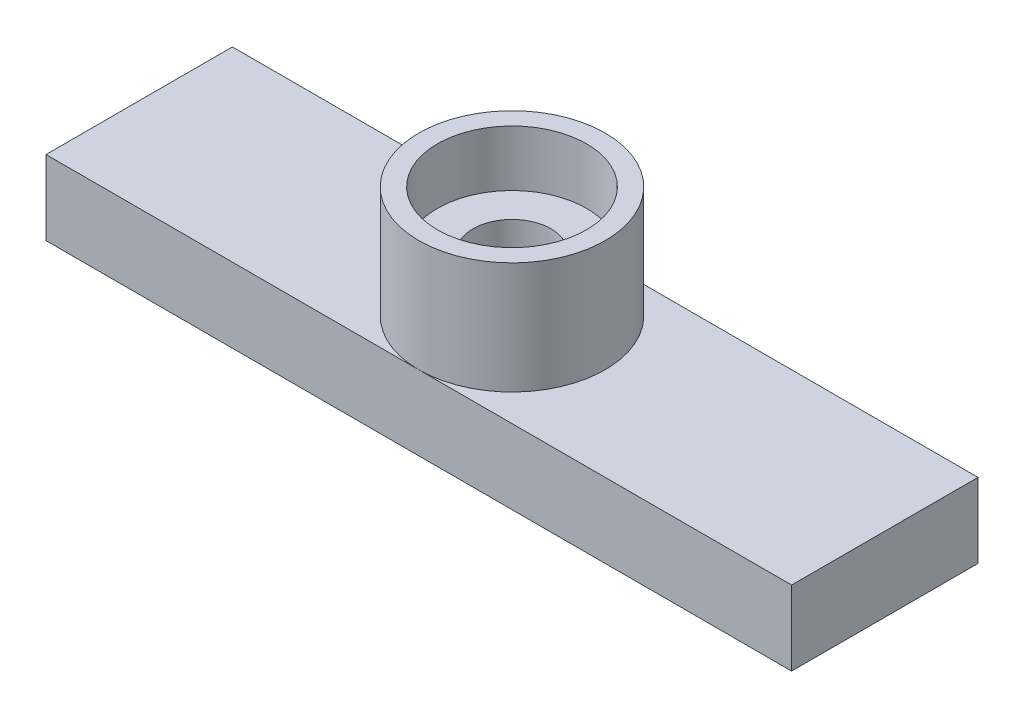
from build123d import *

# Parameters (mm, degrees)
SKETCH1_R           = 4
SKETCH1_R_2         = 2.1
BOSS_EXTRUDE1_DEPTH = 3
SKETCH2_R           = 5
SKETCH2_R_2         = 4
BOSS_EXTRUDE2_DEPTH = 6
BOSS_EXTRUDE3_START = -4
SKETCH3_W           = 40
SKETCH3_H           = 10
SKETCH3_R           = 4
BOSS_EXTRUDE3_DEPTH = 4


with BuildPart() as part:
    # Sketch1 → Boss-Extrude1 (new body)
    with BuildSketch(Plane(origin=(0, 0, 0), x_dir=(1, 0, 0), z_dir=(0, 1, 0))):
        with Locations(Location((0, 0, 0), (0, 0, 270))):
            Circle(SKETCH1_R)
        with Locations(Location((0, 0, 0), (0, 0, 270))):
            Circle(SKETCH1_R_2, mode=Mode.SUBTRACT)
    extrude(amount=BOSS_EXTRUDE1_DEPTH)

    # Sketch2 → Boss-Extrude2 (add)
    with BuildSketch(Plane(origin=(0, 0, 0), x_dir=(1, 0, 0), z_dir=(0, 1, 0))):
        with Locations(Location((0, 0, 0), (0, 0, 270))):
            Circle(SKETCH2_R)
        with Locations(Location((0, 0, 0), (0, 0, 270))):
            Circle(SKETCH2_R_2, mode=Mode.SUBTRACT)
    extrude(amount=BOSS_EXTRUDE2_DEPTH)

    # Sketch3 → Boss-Extrude3 (add)
    with BuildSketch(Plane(origin=(0, 0, 0), x_dir=(1, 0, 0), z_dir=(0, 1, 0)).offset(BOSS_EXTRUDE3_START)):
        Rectangle(SKETCH3_W, SKETCH3_H)
        with Locations(Location((0, 0, 0), (0, 0, 270))):
            Circle(SKETCH3_R, mode=Mode.SUBTRACT)
    extrude(amount=BOSS_EXTRUDE3_DEPTH)


solid = part.part
